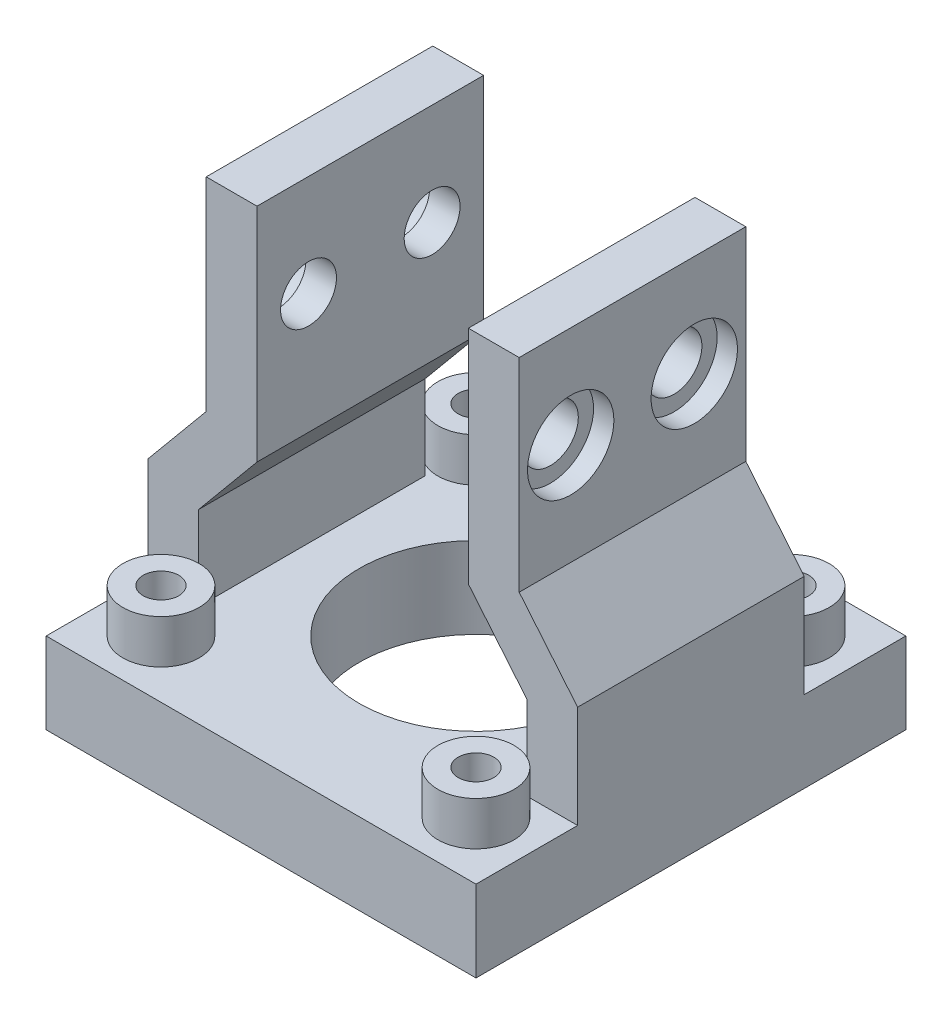
from build123d import *

# Parameters (mm, degrees)
SKETCH1_W           = 42.3
SKETCH1_H           = 42.3
SKETCH1_R           = 1.75
SKETCH1_R_2         = 11.5
BOSS_EXTRUDE1_DEPTH = 8
BOSS_EXTRUDE2_START = -10
BOSS_EXTRUDE2_DEPTH = 22.3
SKETCH4_R           = 2.75
CUT_EXTRUDE1_DEPTH  = 62.713839627
SKETCH5_R           = 3.75
SKETCH5_R_2         = 1.75
BOSS_EXTRUDE3_DEPTH = 4.3
SKETCH7_R           = 4.25
CUT_EXTRUDE2_DEPTH  = 2
CUT_EXTRUDE3_START  = -2
SKETCH8_R           = 4.25
CUT_EXTRUDE3_DEPTH  = 2


with BuildPart() as part:
    # Sketch1 → Boss-Extrude1 (new body)
    with BuildSketch(Plane(origin=(0, 0, 0), x_dir=(1, 0, 0), z_dir=(0, 1, 0))):
        Rectangle(SKETCH1_W, SKETCH1_H)
        with Locations(Location((-15.5, 15.5, 0), (0, 0, 270))):
            Circle(SKETCH1_R, mode=Mode.SUBTRACT)
        with Locations(Location((15.5, 15.5, 0), (0, 0, 90))):
            Circle(SKETCH1_R, mode=Mode.SUBTRACT)
        with Locations(Location((15.5, -15.5, 0), (0, 0, 270))):
            Circle(SKETCH1_R, mode=Mode.SUBTRACT)
        with Locations(Location((-15.5, -15.5, 0), (0, 0, 90))):
            Circle(SKETCH1_R, mode=Mode.SUBTRACT)
        with Locations(Location((0, 0, 0), (0, 0, 270))):
            Circle(SKETCH1_R_2, mode=Mode.SUBTRACT)
    extrude(amount=BOSS_EXTRUDE1_DEPTH)

    # Sketch3 → Boss-Extrude2 (add)
    with BuildSketch(Plane.XY.offset(21.15).offset(BOSS_EXTRUDE2_START)):
        Polygon((-21.15, 8), (-21.15, 18.080453059), (-15.4, 25.004144271), (-15.4, 45.004144271), (-10.4, 45.004144271), (-10.4, 23.198658368), (-16.15, 16.274967156), (-16.15, 8), align=None)
        Polygon((16.15, 16.274967156), (16.15, 8), (21.15, 8), (21.15, 18.080453059), (15.4, 25.004144271), (15.4, 45.004144271), (10.4, 45.004144271), (10.4, 23.198658368), align=None)
    extrude(amount=-BOSS_EXTRUDE2_DEPTH)

    # Sketch4 → Cut-Extrude1 (cut, through all)
    with BuildSketch(Plane.ZY.offset(15.4)):
        with Locations(Location((-6.081010951, 35.004144271, 0), (0, 0, 270))):
            Circle(SKETCH4_R)
        with Locations(Location((6.081010951, 35.004144271, 0), (0, 0, 270))):
            Circle(SKETCH4_R)
    extrude(amount=-CUT_EXTRUDE1_DEPTH, mode=Mode.SUBTRACT)

    # Sketch5 → Boss-Extrude3 (add)
    # profile 1 of 4: a face of its own
    with BuildSketch(Plane(origin=(0, 8, 0), x_dir=(1, 0, 0), z_dir=(0, 1, 0))):
        with Locations(Location((-15.5, 15.5, 0), (0, 0, 90))):
            Circle(SKETCH5_R)
        with Locations(Location((-15.5, 15.5, 0), (0, 0, 270))):
            Circle(SKETCH5_R_2, mode=Mode.SUBTRACT)
    # profile 2 of 4: a face of its own
    with BuildSketch(Plane(origin=(0, 8, 0), x_dir=(1, 0, 0), z_dir=(0, 1, 0))):
        with Locations(Location((15.5, 15.5, 0), (0, 0, 90))):
            Circle(SKETCH5_R)
        with Locations(Location((15.5, 15.5, 0), (0, 0, 90))):
            Circle(SKETCH5_R_2, mode=Mode.SUBTRACT)
    # profile 3 of 4: a face of its own
    with BuildSketch(Plane(origin=(0, 8, 0), x_dir=(1, 0, 0), z_dir=(0, 1, 0))):
        with Locations(Location((15.5, -15.5, 0), (0, 0, 90))):
            Circle(SKETCH5_R)
        with Locations(Location((15.5, -15.5, 0), (0, 0, 270))):
            Circle(SKETCH5_R_2, mode=Mode.SUBTRACT)
    # profile 4 of 4: a face of its own
    with BuildSketch(Plane(origin=(0, 8, 0), x_dir=(1, 0, 0), z_dir=(0, 1, 0))):
        with Locations(Location((-15.5, -15.5, 0), (0, 0, 90))):
            Circle(SKETCH5_R)
        with Locations(Location((-15.5, -15.5, 0), (0, 0, 90))):
            Circle(SKETCH5_R_2, mode=Mode.SUBTRACT)
    extrude(amount=BOSS_EXTRUDE3_DEPTH)

    # Sketch7 → Cut-Extrude2 (cut)
    with BuildSketch(Plane.ZY.offset(15.4)):
        with Locations((-6.081010951, 35.004144271)):
            Circle(SKETCH7_R)
        with Locations((6.081010951, 35.004144271)):
            Circle(SKETCH7_R)
    extrude(amount=-CUT_EXTRUDE2_DEPTH, mode=Mode.SUBTRACT)

    # Sketch8 → Cut-Extrude3 (cut)
    with BuildSketch(Plane(origin=(15.4, 0, 0), x_dir=(0, 0, -1), z_dir=(1, 0, 0)).offset(CUT_EXTRUDE3_START)):
        with Locations(Location((-6.081010951, 35.004144271, 0), (0, 0, 180))):
            Circle(SKETCH8_R)
        with Locations(Location((6.081010951, 35.004144271, 0), (0, 0, 180))):
            Circle(SKETCH8_R)
    extrude(amount=CUT_EXTRUDE3_DEPTH, mode=Mode.SUBTRACT)


solid = part.part
